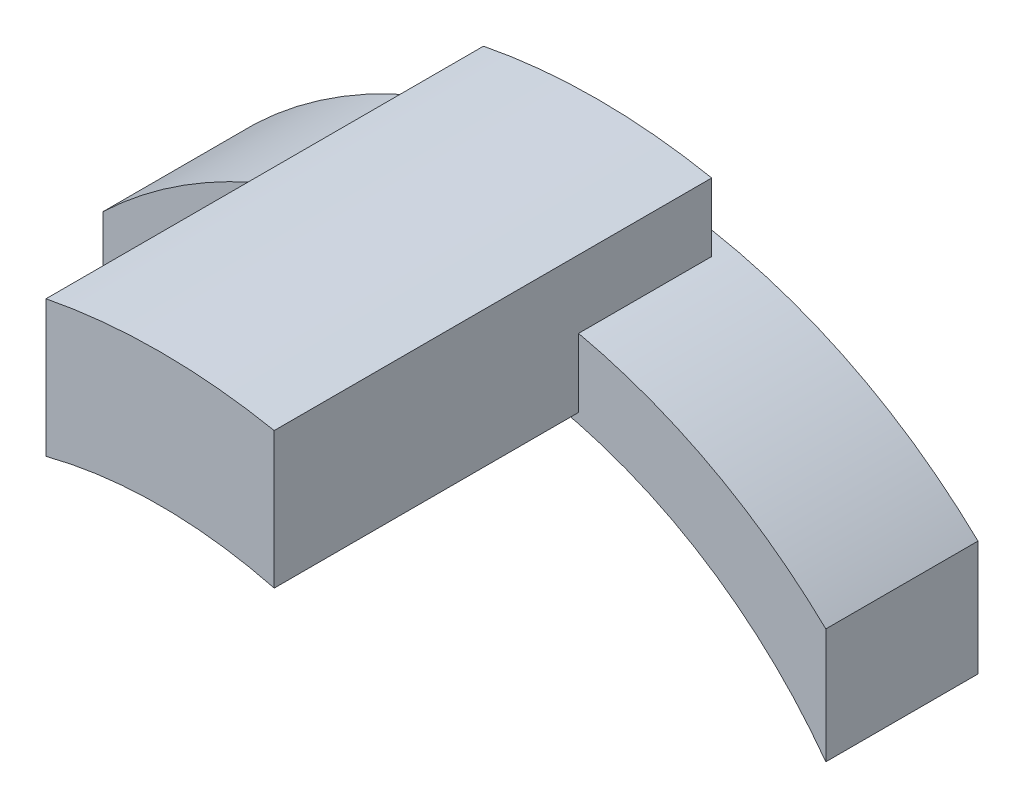
from build123d import *

# Parameters (mm, degrees)
EXTRUDE1_DEPTH      = 4
EXTRUDE2_DEPTH      = 7
EXTRUDE2_DEPTH_BACK = 16


with BuildPart() as part:
    # Sketch1 → Extrude1 (new, symmetric)
    with BuildSketch(Plane.XY):
        with BuildLine():
            Line((-19, 13.829316686), (-19, 19.880895352))
            ThreePointArc((-19, 19.880895352), (0, 27.5), (19, 19.880895352))
            Line((19, 19.880895352), (19, 13.829316686))
            ThreePointArc((19, 13.829316686), (0, 23.5), (-19, 13.829316686))
        make_face()
    extrude(amount=EXTRUDE1_DEPTH, both=True)

    # Sketch2 → Extrude2 (add, two sides: drawn at the far end of the back side and taken through both)
    with BuildSketch(Plane(origin=(0, 0, 4), x_dir=(-1, 0, 0), z_dir=(0, 0, -1)).offset(-EXTRUDE2_DEPTH_BACK)):
        with BuildLine():
            Line((6, 23.237900077), (6, 30.413812651))
            ThreePointArc((6, 30.413812651), (0, 31), (-6, 30.413812651))
            Line((-6, 30.413812651), (-6, 23.237900077))
            ThreePointArc((-6, 23.237900077), (0, 24), (6, 23.237900077))
        make_face()
    extrude(amount=EXTRUDE2_DEPTH + EXTRUDE2_DEPTH_BACK)


solid = part.part
